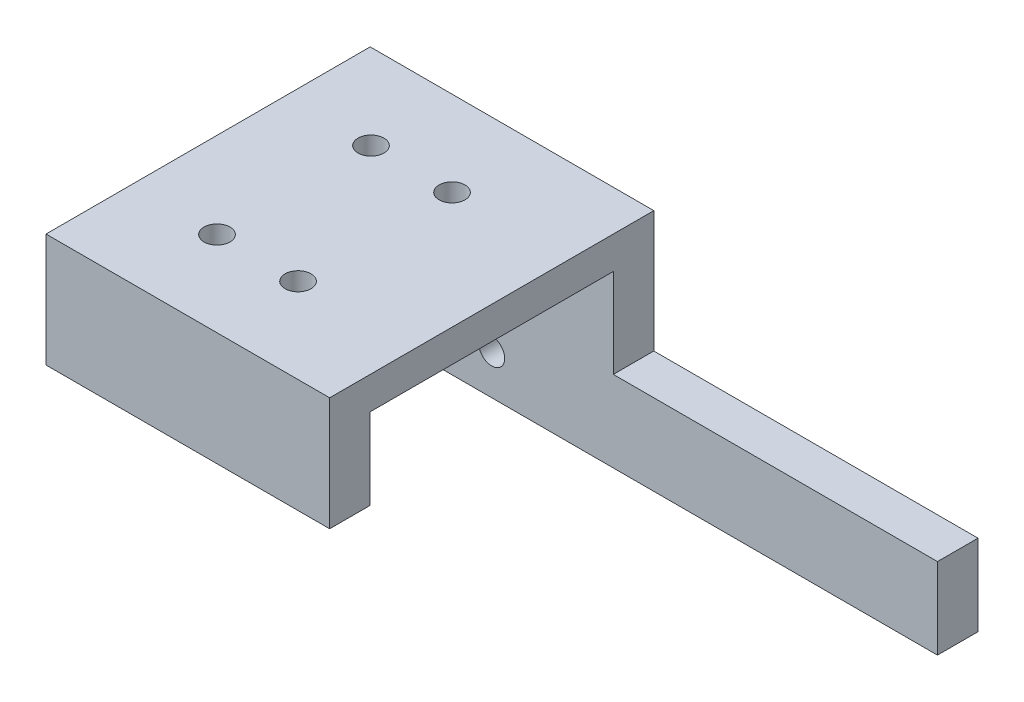
from build123d import *

# Parameters (mm, degrees)
SKETCH_1_W          = 35
SKETCH_1_H          = 40
EXTRUDE_1_DEPTH     = 4
SKETCH_2_R          = 1.6
CUT_EXTRUDE_1_DEPTH = 6
SKETCH_3_W          = 35
SKETCH_3_H          = 5
EXTRUDE_2_DEPTH     = 21
SKETCH_4_R          = 1.6
CUT_EXTRUDE_2_DEPTH = 15
SKETCH_5_R          = 2.8
CUT_EXTRUDE_3_DEPTH = 2
SKETCH_6_W          = 40
SKETCH_6_H          = 10
EXTRUDE_3_DEPTH     = 5
SKETCH_7_W          = 35
SKETCH_7_H          = 5
EXTRUDE_4_DEPTH     = 10


with BuildPart() as part:
    # 草图1 → 凸台-拉伸1 (new body)
    with BuildSketch(Plane(origin=(0, 0, 0), x_dir=(1, 0, 0), z_dir=(0, 1, 0))):
        with Locations((17.5, 20)):
            Rectangle(SKETCH_1_W, SKETCH_1_H)
    extrude(amount=EXTRUDE_1_DEPTH)

    # 草图2 → 切除-拉伸1 (cut)
    with BuildSketch(Plane(origin=(0, 4, 0), x_dir=(1, 0, 0), z_dir=(0, 1, 0))):
        with Locations(Location((10.6, 29.5, 0), (0, 0, 270))):
            Circle(SKETCH_2_R)
        with Locations(Location((20.6, 29.5, 0), (0, 0, 90))):
            Circle(SKETCH_2_R)
        with Locations(Location((20.6, 10.5, 0), (0, 0, 270))):
            Circle(SKETCH_2_R)
        with Locations(Location((10.6, 10.5, 0), (0, 0, 90))):
            Circle(SKETCH_2_R)
    extrude(amount=-CUT_EXTRUDE_1_DEPTH, mode=Mode.SUBTRACT)

    # 草图3 → 凸台-拉伸2 (add)
    with BuildSketch(Plane.XZ):
        with Locations((17.5, -37.5)):
            Rectangle(SKETCH_3_W, SKETCH_3_H)
    extrude(amount=EXTRUDE_2_DEPTH)

    # 草图4 → 切除-拉伸2 (cut)
    with BuildSketch(Plane(origin=(0, 0, -40), x_dir=(-1, 0, 0), z_dir=(0, 0, -1))):
        with Locations((-10, -16)):
            Circle(SKETCH_4_R)
        with Locations((-20, -16)):
            Circle(SKETCH_4_R)
    extrude(amount=-CUT_EXTRUDE_2_DEPTH, mode=Mode.SUBTRACT)

    # 草图5 → 切除-拉伸3 (cut)
    with BuildSketch(Plane(origin=(0, 0, -40), x_dir=(-1, 0, 0), z_dir=(0, 0, -1))):
        with Locations((-20, -16)):
            Circle(SKETCH_5_R)
        with Locations((-10, -16)):
            Circle(SKETCH_5_R)
    extrude(amount=-CUT_EXTRUDE_3_DEPTH, mode=Mode.SUBTRACT)

    # 草图6 → 凸台-拉伸3 (add)
    with BuildSketch(Plane(origin=(0, 0, -40), x_dir=(-1, 0, 0), z_dir=(0, 0, -1))):
        with Locations((-55, -16)):
            Rectangle(SKETCH_6_W, SKETCH_6_H)
    extrude(amount=-EXTRUDE_3_DEPTH)

    # 草图7 → 凸台-拉伸4 (add)
    with BuildSketch(Plane.XZ):
        with Locations((17.5, -2.5)):
            Rectangle(SKETCH_7_W, SKETCH_7_H)
    extrude(amount=EXTRUDE_4_DEPTH)


solid = part.part
